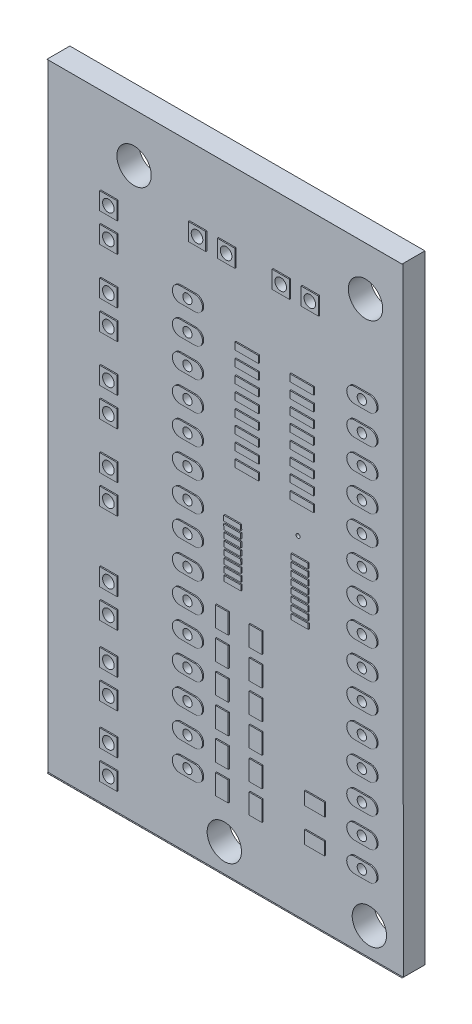
from build123d import *

# Parameters (mm, degrees)
SKETCH_20_R         = 1.5
BOSS_EXTRUDE1_DEPTH = 2
SKETCH_17_W         = 31.032
SKETCH_17_H         = 54.008
SKETCH_17_W_2       = 1.524
SKETCH_17_H_2       = 1.524
SKETCH_17_W_3       = 12.108552041
SKETCH_17_H_3       = 39.16566496
CUT_EXTRUDE1_DEPTH  = 0.1
SKETCH_31_W         = 12.108552041
SKETCH_31_H         = 39.16566496
SKETCH_31_W_2       = 1.1176
SKETCH_31_H_2       = 1.7526
SKETCH_31_W_3       = 1.7526
SKETCH_31_H_3       = 1.1176
SKETCH_31_W_4       = 2.0574
SKETCH_31_H_4       = 0.6096
CUT_EXTRUDE10_DEPTH = 0.1
SKETCH_44_R         = 0.508
SKETCH_44_R_2       = 0.4064
SKETCH_44_R_3       = 0.175
CUT_EXTRUDE11_DEPTH = 63.33289074


with BuildPart() as part:
    # Sketch 20 → Boss-Extrude1 (new body)
    with BuildSketch(Plane.XY):
        Polygon((31.012, 54.028), (-0.01, 54.018), (0, 0), (31.022, 0.01), align=None)
        with Locations((28.0596, 2.4274)):
            Circle(SKETCH_20_R, mode=Mode.SUBTRACT)
        with Locations((15.385, 2.4528)):
            Circle(SKETCH_20_R, mode=Mode.SUBTRACT)
        with Locations((27.723, 49.6996)):
            Circle(SKETCH_20_R, mode=Mode.SUBTRACT)
        with Locations((7.4998, 49.6658)):
            Circle(SKETCH_20_R, mode=Mode.SUBTRACT)
    extrude(amount=-BOSS_EXTRUDE1_DEPTH)

    # Sketch 17 → Cut-Extrude1 (cut)
    with BuildSketch(Plane.XY):
        with Locations((15.506, 27.014)):
            Rectangle(SKETCH_17_W, SKETCH_17_H)
        with Locations((5.354, 17.164)):
            Rectangle(SKETCH_17_W_2, SKETCH_17_H_2, mode=Mode.SUBTRACT)
        with Locations((5.354, 14.624)):
            Rectangle(SKETCH_17_W_2, SKETCH_17_H_2, mode=Mode.SUBTRACT)
        with Locations((5.354, 11.068)):
            Rectangle(SKETCH_17_W_2, SKETCH_17_H_2, mode=Mode.SUBTRACT)
        with Locations((5.354, 8.528)):
            Rectangle(SKETCH_17_W_2, SKETCH_17_H_2, mode=Mode.SUBTRACT)
        with Locations((5.354, 4.972)):
            Rectangle(SKETCH_17_W_2, SKETCH_17_H_2, mode=Mode.SUBTRACT)
        with Locations((5.354, 2.432)):
            Rectangle(SKETCH_17_W_2, SKETCH_17_H_2, mode=Mode.SUBTRACT)
        with Locations((5.354, 25.8)):
            Rectangle(SKETCH_17_W_2, SKETCH_17_H_2, mode=Mode.SUBTRACT)
        with Locations((5.354, 23.26)):
            Rectangle(SKETCH_17_W_2, SKETCH_17_H_2, mode=Mode.SUBTRACT)
        with Locations((5.354, 32.404)):
            Rectangle(SKETCH_17_W_2, SKETCH_17_H_2, mode=Mode.SUBTRACT)
        with Locations((5.354, 29.864)):
            Rectangle(SKETCH_17_W_2, SKETCH_17_H_2, mode=Mode.SUBTRACT)
        with Locations((5.354, 39.008)):
            Rectangle(SKETCH_17_W_2, SKETCH_17_H_2, mode=Mode.SUBTRACT)
        with Locations((5.354, 36.468)):
            Rectangle(SKETCH_17_W_2, SKETCH_17_H_2, mode=Mode.SUBTRACT)
        with Locations((22.958, 47.196)):
            Rectangle(SKETCH_17_W_2, SKETCH_17_H_2, mode=Mode.SUBTRACT)
        with Locations((20.418, 47.196)):
            Rectangle(SKETCH_17_W_2, SKETCH_17_H_2, mode=Mode.SUBTRACT)
        with Locations((5.354, 45.612)):
            Rectangle(SKETCH_17_W_2, SKETCH_17_H_2, mode=Mode.SUBTRACT)
        with Locations((5.354, 43.072)):
            Rectangle(SKETCH_17_W_2, SKETCH_17_H_2, mode=Mode.SUBTRACT)
        with Locations((15.64, 47.156)):
            Rectangle(SKETCH_17_W_2, SKETCH_17_H_2, mode=Mode.SUBTRACT)
        with Locations((13.1, 47.156)):
            Rectangle(SKETCH_17_W_2, SKETCH_17_H_2, mode=Mode.SUBTRACT)
        with Locations((19.91627602, 24.25116752)):
            Rectangle(SKETCH_17_W_3, SKETCH_17_H_3, mode=Mode.SUBTRACT)
        with BuildLine():
            Line((26.8416, 41.3736), (28.1624, 41.3736))
            ThreePointArc((28.1624, 41.3736), (28.8228, 42.034), (28.1624, 42.6944))
            Line((28.1624, 42.6944), (26.8416, 42.6944))
            ThreePointArc((26.8416, 42.6944), (26.1812, 42.034), (26.8416, 41.3736))
        make_face(mode=Mode.SUBTRACT)
        with BuildLine():
            Line((26.8416, 38.8336), (28.1624, 38.8336))
            ThreePointArc((28.1624, 38.8336), (28.8228, 39.494), (28.1624, 40.1544))
            Line((28.1624, 40.1544), (26.8416, 40.1544))
            ThreePointArc((26.8416, 40.1544), (26.1812, 39.494), (26.8416, 38.8336))
        make_face(mode=Mode.SUBTRACT)
        with BuildLine():
            Line((26.8416, 36.2936), (28.1624, 36.2936))
            ThreePointArc((28.1624, 36.2936), (28.8228, 36.954), (28.1624, 37.6144))
            Line((28.1624, 37.6144), (26.8416, 37.6144))
            ThreePointArc((26.8416, 37.6144), (26.1812, 36.954), (26.8416, 36.2936))
        make_face(mode=Mode.SUBTRACT)
        with BuildLine():
            Line((26.8416, 33.7536), (28.1624, 33.7536))
            ThreePointArc((28.1624, 33.7536), (28.8228, 34.414), (28.1624, 35.0744))
            Line((28.1624, 35.0744), (26.8416, 35.0744))
            ThreePointArc((26.8416, 35.0744), (26.1812, 34.414), (26.8416, 33.7536))
        make_face(mode=Mode.SUBTRACT)
        with BuildLine():
            Line((26.8416, 31.2136), (28.1624, 31.2136))
            ThreePointArc((28.1624, 31.2136), (28.8228, 31.874), (28.1624, 32.5344))
            Line((28.1624, 32.5344), (26.8416, 32.5344))
            ThreePointArc((26.8416, 32.5344), (26.1812, 31.874), (26.8416, 31.2136))
        make_face(mode=Mode.SUBTRACT)
        with BuildLine():
            Line((26.8416, 28.6736), (28.1624, 28.6736))
            ThreePointArc((28.1624, 28.6736), (28.8228, 29.334), (28.1624, 29.9944))
            Line((28.1624, 29.9944), (26.8416, 29.9944))
            ThreePointArc((26.8416, 29.9944), (26.1812, 29.334), (26.8416, 28.6736))
        make_face(mode=Mode.SUBTRACT)
        with BuildLine():
            Line((26.8416, 26.1336), (28.1624, 26.1336))
            ThreePointArc((28.1624, 26.1336), (28.8228, 26.794), (28.1624, 27.4544))
            Line((28.1624, 27.4544), (26.8416, 27.4544))
            ThreePointArc((26.8416, 27.4544), (26.1812, 26.794), (26.8416, 26.1336))
        make_face(mode=Mode.SUBTRACT)
        with BuildLine():
            Line((26.8416, 23.5936), (28.1624, 23.5936))
            ThreePointArc((28.1624, 23.5936), (28.8228, 24.254), (28.1624, 24.9144))
            Line((28.1624, 24.9144), (26.8416, 24.9144))
            ThreePointArc((26.8416, 24.9144), (26.1812, 24.254), (26.8416, 23.5936))
        make_face(mode=Mode.SUBTRACT)
        with BuildLine():
            Line((26.8416, 21.0536), (28.1624, 21.0536))
            ThreePointArc((28.1624, 21.0536), (28.8228, 21.714), (28.1624, 22.3744))
            Line((28.1624, 22.3744), (26.8416, 22.3744))
            ThreePointArc((26.8416, 22.3744), (26.1812, 21.714), (26.8416, 21.0536))
        make_face(mode=Mode.SUBTRACT)
        with BuildLine():
            Line((26.8416, 18.5136), (28.1624, 18.5136))
            ThreePointArc((28.1624, 18.5136), (28.8228, 19.174), (28.1624, 19.8344))
            Line((28.1624, 19.8344), (26.8416, 19.8344))
            ThreePointArc((26.8416, 19.8344), (26.1812, 19.174), (26.8416, 18.5136))
        make_face(mode=Mode.SUBTRACT)
        with BuildLine():
            Line((26.8416, 15.9736), (28.1624, 15.9736))
            ThreePointArc((28.1624, 15.9736), (28.8228, 16.634), (28.1624, 17.2944))
            Line((28.1624, 17.2944), (26.8416, 17.2944))
            ThreePointArc((26.8416, 17.2944), (26.1812, 16.634), (26.8416, 15.9736))
        make_face(mode=Mode.SUBTRACT)
        with BuildLine():
            Line((26.8416, 13.4336), (28.1624, 13.4336))
            ThreePointArc((28.1624, 13.4336), (28.8228, 14.094), (28.1624, 14.7544))
            Line((28.1624, 14.7544), (26.8416, 14.7544))
            ThreePointArc((26.8416, 14.7544), (26.1812, 14.094), (26.8416, 13.4336))
        make_face(mode=Mode.SUBTRACT)
        with BuildLine():
            Line((26.8416, 10.8936), (28.1624, 10.8936))
            ThreePointArc((28.1624, 10.8936), (28.8228, 11.554), (28.1624, 12.2144))
            Line((28.1624, 12.2144), (26.8416, 12.2144))
            ThreePointArc((26.8416, 12.2144), (26.1812, 11.554), (26.8416, 10.8936))
        make_face(mode=Mode.SUBTRACT)
        with BuildLine():
            Line((26.8416, 8.3536), (28.1624, 8.3536))
            ThreePointArc((28.1624, 8.3536), (28.8228, 9.014), (28.1624, 9.6744))
            Line((28.1624, 9.6744), (26.8416, 9.6744))
            ThreePointArc((26.8416, 9.6744), (26.1812, 9.014), (26.8416, 8.3536))
        make_face(mode=Mode.SUBTRACT)
        with BuildLine():
            Line((26.8416, 5.8136), (28.1624, 5.8136))
            ThreePointArc((28.1624, 5.8136), (28.8228, 6.474), (28.1624, 7.1344))
            Line((28.1624, 7.1344), (26.8416, 7.1344))
            ThreePointArc((26.8416, 7.1344), (26.1812, 6.474), (26.8416, 5.8136))
        make_face(mode=Mode.SUBTRACT)
        with BuildLine():
            Line((11.6016, 41.3736), (12.9224, 41.3736))
            ThreePointArc((12.9224, 41.3736), (13.5828, 42.034), (12.9224, 42.6944))
            Line((12.9224, 42.6944), (11.6016, 42.6944))
            ThreePointArc((11.6016, 42.6944), (10.9412, 42.034), (11.6016, 41.3736))
        make_face(mode=Mode.SUBTRACT)
        with BuildLine():
            Line((11.6016, 38.8336), (12.9224, 38.8336))
            ThreePointArc((12.9224, 38.8336), (13.5828, 39.494), (12.9224, 40.1544))
            Line((12.9224, 40.1544), (11.6016, 40.1544))
            ThreePointArc((11.6016, 40.1544), (10.9412, 39.494), (11.6016, 38.8336))
        make_face(mode=Mode.SUBTRACT)
        with BuildLine():
            Line((11.6016, 36.2936), (12.9224, 36.2936))
            ThreePointArc((12.9224, 36.2936), (13.5828, 36.954), (12.9224, 37.6144))
            Line((12.9224, 37.6144), (11.6016, 37.6144))
            ThreePointArc((11.6016, 37.6144), (10.9412, 36.954), (11.6016, 36.2936))
        make_face(mode=Mode.SUBTRACT)
        with BuildLine():
            Line((11.6016, 33.7536), (12.9224, 33.7536))
            ThreePointArc((12.9224, 33.7536), (13.5828, 34.414), (12.9224, 35.0744))
            Line((12.9224, 35.0744), (11.6016, 35.0744))
            ThreePointArc((11.6016, 35.0744), (10.9412, 34.414), (11.6016, 33.7536))
        make_face(mode=Mode.SUBTRACT)
        with BuildLine():
            Line((11.6016, 31.2136), (12.9224, 31.2136))
            ThreePointArc((12.9224, 31.2136), (13.5828, 31.874), (12.9224, 32.5344))
            Line((12.9224, 32.5344), (11.6016, 32.5344))
            ThreePointArc((11.6016, 32.5344), (10.9412, 31.874), (11.6016, 31.2136))
        make_face(mode=Mode.SUBTRACT)
        with BuildLine():
            Line((11.6016, 28.6736), (12.9224, 28.6736))
            ThreePointArc((12.9224, 28.6736), (13.5828, 29.334), (12.9224, 29.9944))
            Line((12.9224, 29.9944), (11.6016, 29.9944))
            ThreePointArc((11.6016, 29.9944), (10.9412, 29.334), (11.6016, 28.6736))
        make_face(mode=Mode.SUBTRACT)
        with BuildLine():
            Line((11.6016, 26.1336), (12.9224, 26.1336))
            ThreePointArc((12.9224, 26.1336), (13.5828, 26.794), (12.9224, 27.4544))
            Line((12.9224, 27.4544), (11.6016, 27.4544))
            ThreePointArc((11.6016, 27.4544), (10.9412, 26.794), (11.6016, 26.1336))
        make_face(mode=Mode.SUBTRACT)
        with BuildLine():
            Line((11.6016, 23.5936), (12.9224, 23.5936))
            ThreePointArc((12.9224, 23.5936), (13.5828, 24.254), (12.9224, 24.9144))
            Line((12.9224, 24.9144), (11.6016, 24.9144))
            ThreePointArc((11.6016, 24.9144), (10.9412, 24.254), (11.6016, 23.5936))
        make_face(mode=Mode.SUBTRACT)
        with BuildLine():
            Line((11.6016, 21.0536), (12.9224, 21.0536))
            ThreePointArc((12.9224, 21.0536), (13.5828, 21.714), (12.9224, 22.3744))
            Line((12.9224, 22.3744), (11.6016, 22.3744))
            ThreePointArc((11.6016, 22.3744), (10.9412, 21.714), (11.6016, 21.0536))
        make_face(mode=Mode.SUBTRACT)
        with BuildLine():
            Line((11.6016, 18.5136), (12.9224, 18.5136))
            ThreePointArc((12.9224, 18.5136), (13.5828, 19.174), (12.9224, 19.8344))
            Line((12.9224, 19.8344), (11.6016, 19.8344))
            ThreePointArc((11.6016, 19.8344), (10.9412, 19.174), (11.6016, 18.5136))
        make_face(mode=Mode.SUBTRACT)
        with BuildLine():
            Line((11.6016, 15.9736), (12.9224, 15.9736))
            ThreePointArc((12.9224, 15.9736), (13.5828, 16.634), (12.9224, 17.2944))
            Line((12.9224, 17.2944), (11.6016, 17.2944))
            ThreePointArc((11.6016, 17.2944), (10.9412, 16.634), (11.6016, 15.9736))
        make_face(mode=Mode.SUBTRACT)
        with BuildLine():
            Line((11.6016, 13.4336), (12.9224, 13.4336))
            ThreePointArc((12.9224, 13.4336), (13.5828, 14.094), (12.9224, 14.7544))
            Line((12.9224, 14.7544), (11.6016, 14.7544))
            ThreePointArc((11.6016, 14.7544), (10.9412, 14.094), (11.6016, 13.4336))
        make_face(mode=Mode.SUBTRACT)
        with BuildLine():
            Line((11.6016, 10.8936), (12.9224, 10.8936))
            ThreePointArc((12.9224, 10.8936), (13.5828, 11.554), (12.9224, 12.2144))
            Line((12.9224, 12.2144), (11.6016, 12.2144))
            ThreePointArc((11.6016, 12.2144), (10.9412, 11.554), (11.6016, 10.8936))
        make_face(mode=Mode.SUBTRACT)
        with BuildLine():
            Line((11.6016, 8.3536), (12.9224, 8.3536))
            ThreePointArc((12.9224, 8.3536), (13.5828, 9.014), (12.9224, 9.6744))
            Line((12.9224, 9.6744), (11.6016, 9.6744))
            ThreePointArc((11.6016, 9.6744), (10.9412, 9.014), (11.6016, 8.3536))
        make_face(mode=Mode.SUBTRACT)
        with BuildLine():
            Line((11.6016, 5.8136), (12.9224, 5.8136))
            ThreePointArc((12.9224, 5.8136), (13.5828, 6.474), (12.9224, 7.1344))
            Line((12.9224, 7.1344), (11.6016, 7.1344))
            ThreePointArc((11.6016, 7.1344), (10.9412, 6.474), (11.6016, 5.8136))
        make_face(mode=Mode.SUBTRACT)
    extrude(amount=-CUT_EXTRUDE1_DEPTH, mode=Mode.SUBTRACT)

    # Sketch 31 → Cut-Extrude10 (cut)
    with BuildSketch(Plane.XY):
        with Locations((19.91627602, 24.25116752)):
            Rectangle(SKETCH_31_W, SKETCH_31_H)
        Polygon((15.433788201, 26.792741561), (16.908767982, 26.800464608), (16.906411799, 27.250458439), (15.431432018, 27.242735392), align=None, mode=Mode.SUBTRACT)
        Polygon((15.437191624, 26.142741579), (16.912171405, 26.150464625), (16.909815222, 26.600458457), (15.434835441, 26.59273541), align=None, mode=Mode.SUBTRACT)
        Polygon((15.440595047, 25.492741597), (16.915574828, 25.500464643), (16.913218645, 25.950458475), (15.438238864, 25.942735428), align=None, mode=Mode.SUBTRACT)
        Polygon((15.44399847, 24.842741615), (16.918978252, 24.850464661), (16.916622068, 25.300458493), (15.441642287, 25.292735446), align=None, mode=Mode.SUBTRACT)
        Polygon((15.447401894, 24.192741633), (16.922381675, 24.200464679), (16.920025491, 24.650458511), (15.44504571, 24.642735464), align=None, mode=Mode.SUBTRACT)
        Polygon((15.450805317, 23.542741651), (16.925785098, 23.550464697), (16.923428914, 24.000458529), (15.448449133, 23.992735482), align=None, mode=Mode.SUBTRACT)
        Polygon((15.45420874, 22.892741668), (16.929188521, 22.900464715), (16.926832337, 23.350458547), (15.451852556, 23.3427355), align=None, mode=Mode.SUBTRACT)
        Polygon((15.457688201, 22.242741561), (16.932667982, 22.250464608), (16.930311799, 22.700458439), (15.455332018, 22.692735392), align=None, mode=Mode.SUBTRACT)
        Polygon((21.333588201, 22.273541561), (22.808567982, 22.281264608), (22.806211799, 22.731258439), (21.331232018, 22.723535392), align=None, mode=Mode.SUBTRACT)
        Polygon((21.330184778, 22.923541543), (22.805164559, 22.93126459), (22.802808376, 23.381258421), (21.327828595, 23.373535375), align=None, mode=Mode.SUBTRACT)
        Polygon((21.326781355, 23.573541525), (22.801761136, 23.581264572), (22.799404953, 24.031258403), (21.324425172, 24.023535357), align=None, mode=Mode.SUBTRACT)
        Polygon((21.323377932, 24.223541507), (22.798357713, 24.231264554), (22.79600153, 24.681258385), (21.321021748, 24.673535339), align=None, mode=Mode.SUBTRACT)
        Polygon((21.319974509, 24.873541489), (22.79495429, 24.881264536), (22.792598106, 25.331258367), (21.317618325, 25.323535321), align=None, mode=Mode.SUBTRACT)
        Polygon((21.316571086, 25.523541471), (22.791550867, 25.531264518), (22.789194683, 25.981258349), (21.314214902, 25.973535303), align=None, mode=Mode.SUBTRACT)
        Polygon((21.313167663, 26.173541453), (22.788147444, 26.1812645), (22.78579126, 26.631258332), (21.310811479, 26.623535285), align=None, mode=Mode.SUBTRACT)
        Polygon((21.309688201, 26.823541561), (22.784667982, 26.831264608), (22.782311799, 27.281258439), (21.307332018, 27.273535392), align=None, mode=Mode.SUBTRACT)
        with Locations((15.2608, 19.224)):
            Rectangle(SKETCH_31_W_2, SKETCH_31_H_2, mode=Mode.SUBTRACT)
        with Locations((18.2072, 19.224)):
            Rectangle(SKETCH_31_W_2, SKETCH_31_H_2, mode=Mode.SUBTRACT)
        with Locations((15.2608, 16.684)):
            Rectangle(SKETCH_31_W_2, SKETCH_31_H_2, mode=Mode.SUBTRACT)
        with Locations((18.2072, 16.684)):
            Rectangle(SKETCH_31_W_2, SKETCH_31_H_2, mode=Mode.SUBTRACT)
        with Locations((15.2608, 14.144)):
            Rectangle(SKETCH_31_W_2, SKETCH_31_H_2, mode=Mode.SUBTRACT)
        with Locations((18.2072, 14.144)):
            Rectangle(SKETCH_31_W_2, SKETCH_31_H_2, mode=Mode.SUBTRACT)
        with Locations((15.2608, 11.604)):
            Rectangle(SKETCH_31_W_2, SKETCH_31_H_2, mode=Mode.SUBTRACT)
        with Locations((18.2072, 11.604)):
            Rectangle(SKETCH_31_W_2, SKETCH_31_H_2, mode=Mode.SUBTRACT)
        with Locations((15.2608, 9.064)):
            Rectangle(SKETCH_31_W_2, SKETCH_31_H_2, mode=Mode.SUBTRACT)
        with Locations((18.2072, 9.064)):
            Rectangle(SKETCH_31_W_2, SKETCH_31_H_2, mode=Mode.SUBTRACT)
        with Locations((15.2608, 6.524)):
            Rectangle(SKETCH_31_W_2, SKETCH_31_H_2, mode=Mode.SUBTRACT)
        with Locations((18.2072, 6.524)):
            Rectangle(SKETCH_31_W_2, SKETCH_31_H_2, mode=Mode.SUBTRACT)
        with Locations((23.37, 9.3532)):
            Rectangle(SKETCH_31_W_3, SKETCH_31_H_3, mode=Mode.SUBTRACT)
        with Locations((23.37, 6.4068)):
            Rectangle(SKETCH_31_W_3, SKETCH_31_H_3, mode=Mode.SUBTRACT)
        with Locations((22.2366, 31.64)):
            Rectangle(SKETCH_31_W_4, SKETCH_31_H_4, mode=Mode.SUBTRACT)
        with Locations((22.2366, 32.91)):
            Rectangle(SKETCH_31_W_4, SKETCH_31_H_4, mode=Mode.SUBTRACT)
        with Locations((22.2366, 34.18)):
            Rectangle(SKETCH_31_W_4, SKETCH_31_H_4, mode=Mode.SUBTRACT)
        with Locations((22.2366, 35.45)):
            Rectangle(SKETCH_31_W_4, SKETCH_31_H_4, mode=Mode.SUBTRACT)
        with Locations((22.2366, 36.72)):
            Rectangle(SKETCH_31_W_4, SKETCH_31_H_4, mode=Mode.SUBTRACT)
        with Locations((22.2366, 37.99)):
            Rectangle(SKETCH_31_W_4, SKETCH_31_H_4, mode=Mode.SUBTRACT)
        with Locations((22.2366, 39.26)):
            Rectangle(SKETCH_31_W_4, SKETCH_31_H_4, mode=Mode.SUBTRACT)
        with Locations((22.2366, 40.53)):
            Rectangle(SKETCH_31_W_4, SKETCH_31_H_4, mode=Mode.SUBTRACT)
        with Locations((17.436, 40.53)):
            Rectangle(SKETCH_31_W_4, SKETCH_31_H_4, mode=Mode.SUBTRACT)
        with Locations((17.436, 39.26)):
            Rectangle(SKETCH_31_W_4, SKETCH_31_H_4, mode=Mode.SUBTRACT)
        with Locations((17.436, 37.99)):
            Rectangle(SKETCH_31_W_4, SKETCH_31_H_4, mode=Mode.SUBTRACT)
        with Locations((17.436, 36.72)):
            Rectangle(SKETCH_31_W_4, SKETCH_31_H_4, mode=Mode.SUBTRACT)
        with Locations((17.436, 35.45)):
            Rectangle(SKETCH_31_W_4, SKETCH_31_H_4, mode=Mode.SUBTRACT)
        with Locations((17.436, 34.18)):
            Rectangle(SKETCH_31_W_4, SKETCH_31_H_4, mode=Mode.SUBTRACT)
        with Locations((17.436, 32.91)):
            Rectangle(SKETCH_31_W_4, SKETCH_31_H_4, mode=Mode.SUBTRACT)
        with Locations((17.436, 31.64)):
            Rectangle(SKETCH_31_W_4, SKETCH_31_H_4, mode=Mode.SUBTRACT)
    extrude(amount=-CUT_EXTRUDE10_DEPTH, mode=Mode.SUBTRACT)

    # Sketch 44 → Cut-Extrude11 (cut, through all)
    with BuildSketch(Plane.XY):
        with Locations((5.354, 17.164)):
            Circle(SKETCH_44_R)
        with Locations((5.354, 14.624)):
            Circle(SKETCH_44_R)
        with Locations((5.354, 11.068)):
            Circle(SKETCH_44_R)
        with Locations((5.354, 8.528)):
            Circle(SKETCH_44_R)
        with Locations((5.354, 4.972)):
            Circle(SKETCH_44_R)
        with Locations((5.354, 2.432)):
            Circle(SKETCH_44_R)
        with Locations((5.354, 25.8)):
            Circle(SKETCH_44_R)
        with Locations((5.354, 23.26)):
            Circle(SKETCH_44_R)
        with Locations((5.354, 32.404)):
            Circle(SKETCH_44_R)
        with Locations((5.354, 29.864)):
            Circle(SKETCH_44_R)
        with Locations((5.354, 39.008)):
            Circle(SKETCH_44_R)
        with Locations((5.354, 36.468)):
            Circle(SKETCH_44_R)
        with Locations((22.958, 47.196)):
            Circle(SKETCH_44_R)
        with Locations((20.418, 47.196)):
            Circle(SKETCH_44_R)
        with Locations((5.354, 45.612)):
            Circle(SKETCH_44_R)
        with Locations((5.354, 43.072)):
            Circle(SKETCH_44_R)
        with Locations((15.64, 47.156)):
            Circle(SKETCH_44_R)
        with Locations((13.1, 47.156)):
            Circle(SKETCH_44_R)
        with Locations((27.502, 42.034)):
            Circle(SKETCH_44_R_2)
        with Locations((27.502, 39.494)):
            Circle(SKETCH_44_R_2)
        with Locations((27.502, 36.954)):
            Circle(SKETCH_44_R_2)
        with Locations((27.502, 34.414)):
            Circle(SKETCH_44_R_2)
        with Locations((27.502, 31.874)):
            Circle(SKETCH_44_R_2)
        with Locations((27.502, 29.334)):
            Circle(SKETCH_44_R_2)
        with Locations((27.502, 26.794)):
            Circle(SKETCH_44_R_2)
        with Locations((27.502, 24.254)):
            Circle(SKETCH_44_R_2)
        with Locations((27.502, 21.714)):
            Circle(SKETCH_44_R_2)
        with Locations((27.502, 19.174)):
            Circle(SKETCH_44_R_2)
        with Locations((27.502, 16.634)):
            Circle(SKETCH_44_R_2)
        with Locations((27.502, 14.094)):
            Circle(SKETCH_44_R_2)
        with Locations((27.502, 11.554)):
            Circle(SKETCH_44_R_2)
        with Locations((27.502, 9.014)):
            Circle(SKETCH_44_R_2)
        with Locations((27.502, 6.474)):
            Circle(SKETCH_44_R_2)
        with Locations((12.262, 42.034)):
            Circle(SKETCH_44_R_2)
        with Locations((12.262, 39.494)):
            Circle(SKETCH_44_R_2)
        with Locations((12.262, 36.954)):
            Circle(SKETCH_44_R_2)
        with Locations((12.262, 34.414)):
            Circle(SKETCH_44_R_2)
        with Locations((12.262, 31.874)):
            Circle(SKETCH_44_R_2)
        with Locations((12.262, 29.334)):
            Circle(SKETCH_44_R_2)
        with Locations((12.262, 26.794)):
            Circle(SKETCH_44_R_2)
        with Locations((12.262, 24.254)):
            Circle(SKETCH_44_R_2)
        with Locations((12.262, 21.714)):
            Circle(SKETCH_44_R_2)
        with Locations((12.262, 19.174)):
            Circle(SKETCH_44_R_2)
        with Locations((12.262, 16.634)):
            Circle(SKETCH_44_R_2)
        with Locations((12.262, 14.094)):
            Circle(SKETCH_44_R_2)
        with Locations((12.262, 11.554)):
            Circle(SKETCH_44_R_2)
        with Locations((12.262, 9.014)):
            Circle(SKETCH_44_R_2)
        with Locations((12.262, 6.474)):
            Circle(SKETCH_44_R_2)
        with Locations((21.826, 28.816)):
            Circle(SKETCH_44_R_3)
    extrude(amount=-CUT_EXTRUDE11_DEPTH, mode=Mode.SUBTRACT)


solid = part.part
